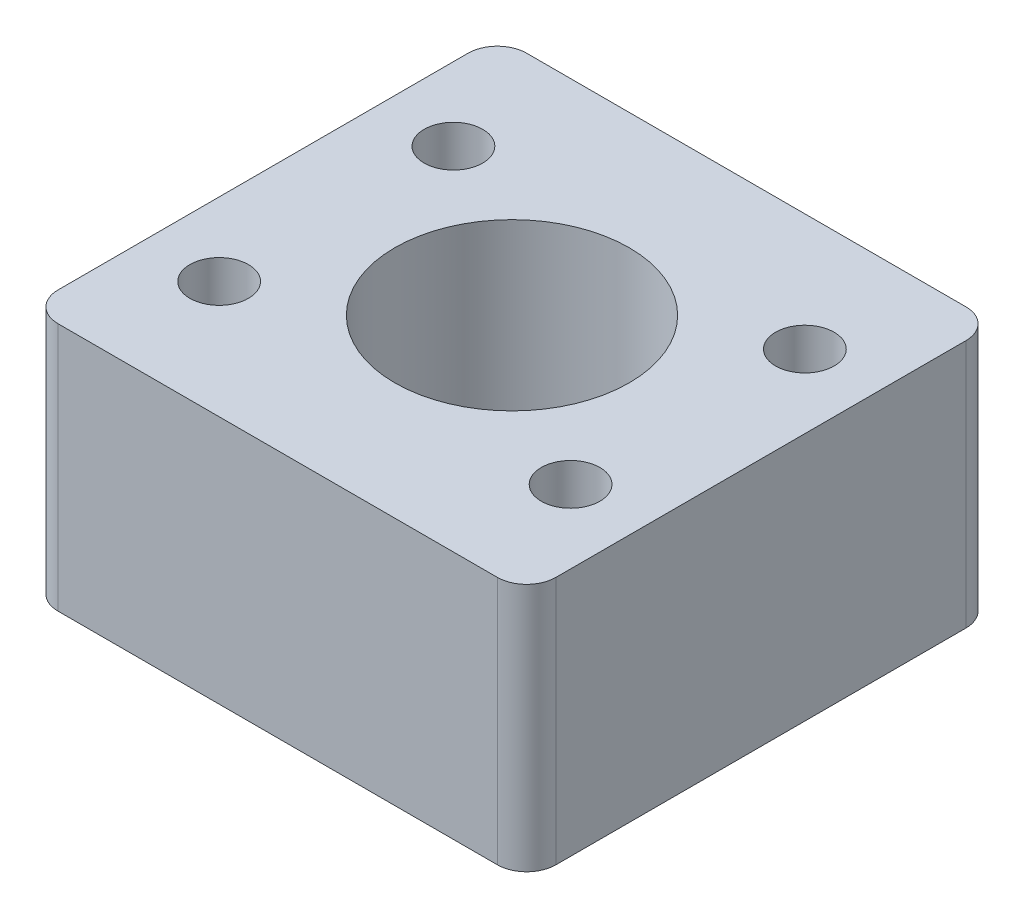
from build123d import *

# Parameters (mm, degrees)
SKETCH_1_W      = 17
SKETCH_1_H      = 16
SKETCH_1_R      = 1
SKETCH_1_R_2    = 4
EXTRUDE_1_DEPTH = 8.5
FILLET_1_R      = 1


with BuildPart() as part:
    # 草图1 → 凸台-拉伸1 (new body)
    with BuildSketch(Plane(origin=(0, 0, 0), x_dir=(1, 0, 0), z_dir=(0, 1, 0))):
        Rectangle(SKETCH_1_W, SKETCH_1_H)
        with Locations(Location((6, 4, 0), (0, 0, 270))):
            Circle(SKETCH_1_R, mode=Mode.SUBTRACT)
        with Locations(Location((-6, 4, 0), (0, 0, 90))):
            Circle(SKETCH_1_R, mode=Mode.SUBTRACT)
        with Locations(Location((6, -4, 0), (0, 0, 90))):
            Circle(SKETCH_1_R, mode=Mode.SUBTRACT)
        with Locations(Location((-6, -4, 0), (0, 0, 270))):
            Circle(SKETCH_1_R, mode=Mode.SUBTRACT)
        with Locations(Location((0, 0, 0), (0, 0, 270))):
            Circle(SKETCH_1_R_2, mode=Mode.SUBTRACT)
    extrude(amount=EXTRUDE_1_DEPTH)

    # 圆角1
    fillet_1_edges = [part.edges().sort_by_distance(p)[0] for p in [
        (8.5, 4.25, 8),
        (-8.5, 4.25, 8),
        (-8.5, 4.25, -8),
        (8.5, 4.25, -8),
    ]]
    fillet(fillet_1_edges, radius=FILLET_1_R)


solid = part.part
